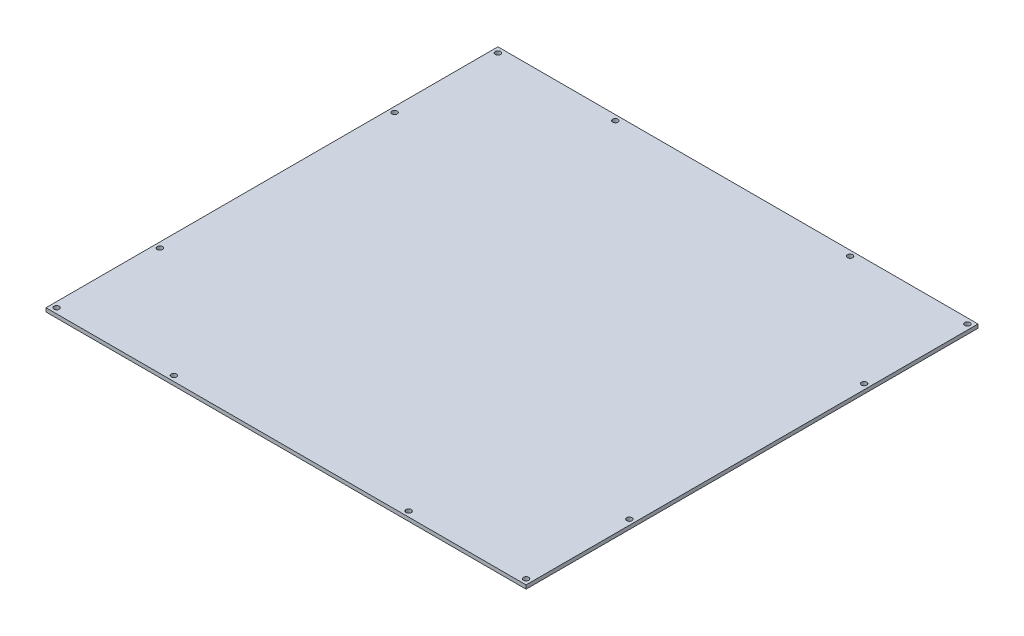
from build123d import *

# Parameters (mm, degrees)
SKETCH1_W            = 409
SKETCH1_H            = 385
BOSS_EXTRUDE1_DEPTH  = 3.175
M4_CLEARANCE_HOLE1_D = 4.5


with BuildPart() as part:
    # Sketch1 → Boss-Extrude1 (new body)
    with BuildSketch(Plane(origin=(0, 0, 0), x_dir=(1, 0, 0), z_dir=(0, 1, 0))):
        Rectangle(SKETCH1_W, SKETCH1_H)
    extrude(amount=BOSS_EXTRUDE1_DEPTH)

    # M4 Clearance Hole1 (through all)
    with Locations(Plane(origin=(0, 3.175, 0), x_dir=(1, 0, 0), z_dir=(0, 1, 0))):
        with Locations((-200, 188), (-200, 100), (-200, -100), (200, -100), (200, 100), (200, 188), (-100, 188), (100, 188), (100, -188), (-100, -188), (200, -188), (-200, -188)):
            Hole(M4_CLEARANCE_HOLE1_D / 2)


solid = part.part
